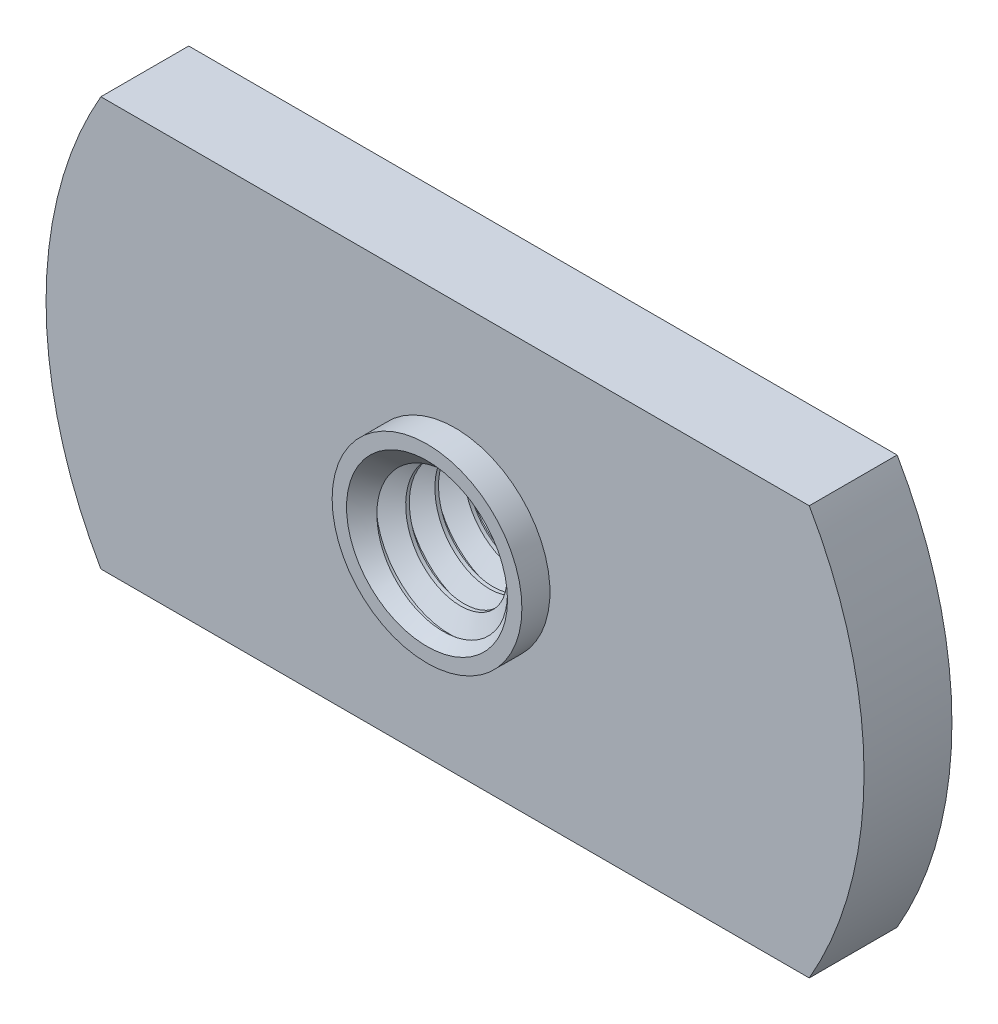
from build123d import *

# Parameters (mm, degrees)
SKETCH3_R              = 2.0828
BOSS_EXTRUDE1_DEPTH    = 2.3876
BOSS_EXTRUDE2_START    = 0.762
SKETCH4_R              = 2.5781
SKETCH4_R_2            = 2.0828
BOSS_EXTRUDE2_DEPTH    = 0.762
SKETCH6_R              = 2.0828
BOSS_EXTRUDE3_DEPTH    = 3.1496
CUT_SWEEP1_PITCH       = 0.79375
CUT_SWEEP1_HEIGHT      = 3.94335
CUT_SWEEP1_RADIUS      = 2.0828
CUT_SWEEP1_START_ANGLE = 90
SKETCH10_R             = 2.5781
BOSS_EXTRUDE5_DEPTH    = 3.1496


with BuildPart() as part:
    # Sketch3 → Boss-Extrude1 (new body)
    with BuildSketch(Plane.XY):
        with BuildLine():
            Line((9.6237073, -5.55625), (-9.6237073, -5.55625))
            ThreePointArc((-9.6237073, -5.55625), (-11.1125, 0), (-9.6237073, 5.55625))
            Line((-9.6237073, 5.55625), (9.6237073, 5.55625))
            ThreePointArc((9.6237073, 5.55625), (11.1125, 0), (9.6237073, -5.55625))
        make_face()
        Circle(SKETCH3_R, mode=Mode.SUBTRACT)
    extrude(amount=-BOSS_EXTRUDE1_DEPTH)

    # Sketch4 → Boss-Extrude2 (add)
    with BuildSketch(Plane.XY.offset(BOSS_EXTRUDE2_START)):
        with Locations(Location((0, 0, 0), (0, 0, 180))):
            Circle(SKETCH4_R)
        Circle(SKETCH4_R_2, mode=Mode.SUBTRACT)
    extrude(amount=-BOSS_EXTRUDE2_DEPTH)

    # Cut-Extrude1 cone 1 section (through the dimple's axis) → Cut-Extrude1 (revolve, cut)
    with BuildSketch(Plane(origin=(0, 0, 0.762), x_dir=(0, -1, 0), z_dir=(1, 0, 0))):
        Polygon((0, 0), (2.18694, 0), (0, 2.18694), align=None)
    revolve(axis=Axis((0, 0, 0.762), (0, 0, -1)), mode=Mode.SUBTRACT)

    # Sketch10 → Boss-Extrude5 (add)
    with BuildSketch(Plane.XY.offset(0.762)):
        with Locations(Location((0, 0, 0), (0, 0, 180))):
            Circle(SKETCH10_R)
    extrude(amount=-BOSS_EXTRUDE5_DEPTH)


with BuildPart() as body_2:
    # Sketch6 → Boss-Extrude3 (new body)
    with BuildSketch(Plane.XY.offset(0.762)):
        Circle(SKETCH6_R)
    extrude(amount=-BOSS_EXTRUDE3_DEPTH)

    # Cut-Sweep1: sweep along a helix
    with BuildLine() as cut_sweep1_path:
        add(Helix(CUT_SWEEP1_PITCH, CUT_SWEEP1_HEIGHT, CUT_SWEEP1_RADIUS, center=(0, 0, 0.762), direction=(0, 0, -1), mode=Mode.PRIVATE).rotate(Axis((0, 0, 0.762), (0, 0, -1)), CUT_SWEEP1_START_ANGLE))
    # Sketch8 → Cut-Sweep1 (sweep, cut)
    with BuildSketch(Plane(origin=(0, 0, 0), x_dir=(0, 0, -1), z_dir=(1, 0, 0))):
        Polygon((-1.481335937, 2.125762979), (-0.712390625, 2.168725958), (-1.05965625, 1.567244252), (-1.158875, 1.567244252), align=None)
    sweep(path=cut_sweep1_path.line, is_frenet=True, mode=Mode.SUBTRACT)

    # Boss-Extrude4 cone 1 section (through the dimple's axis) → Boss-Extrude4 (revolve)
    with BuildSketch(Plane(origin=(0, 0, 0.762), x_dir=(0, -1, 0), z_dir=(1, 0, 0))):
        Polygon((0, 0), (2.18694, 0), (0, 2.18694), align=None)
    revolve(axis=Axis((0, 0, 0.762), (0, 0, -1)))


with BuildPart() as part_1:
    add(part.part)

    # Combine1: cut body 2
    add(body_2.part, mode=Mode.SUBTRACT)


solid = part_1.part
